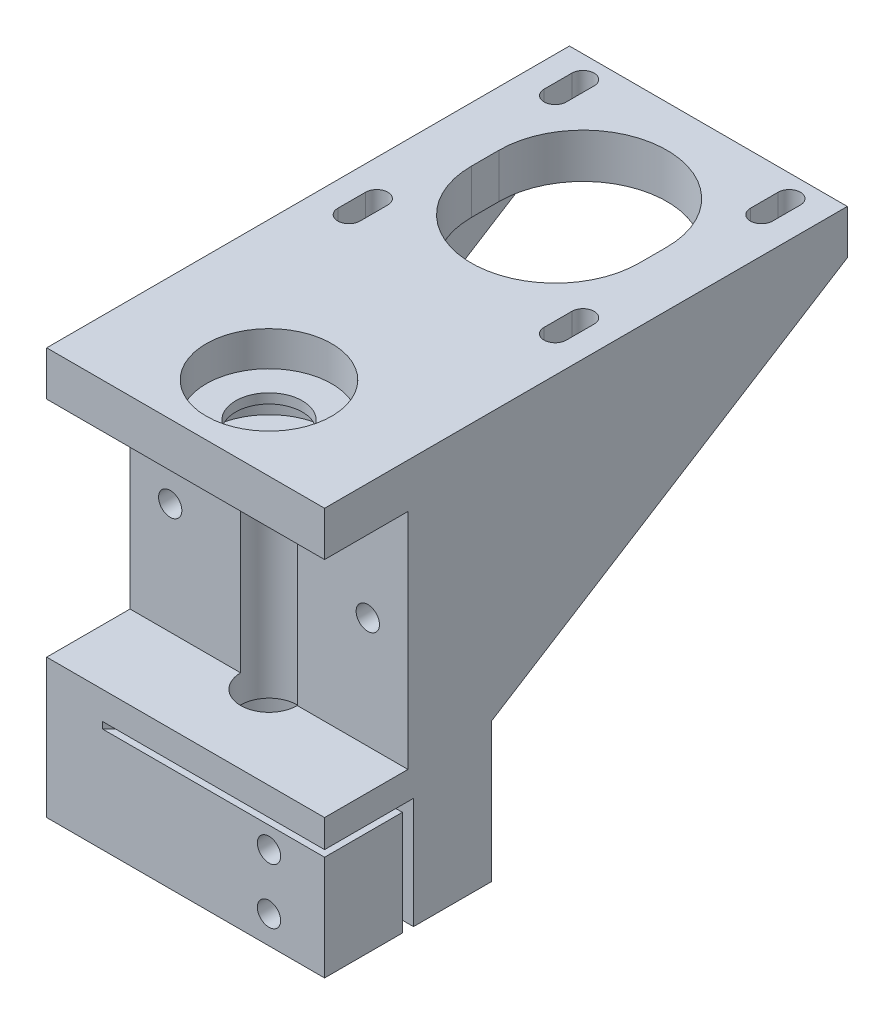
from build123d import *

# Parameters (mm, degrees)
SKETCH1_W            = 50.8
SKETCH1_H            = 38.1
SKETCH1_R            = 13.335
BOSS_EXTRUDE2_DEPTH  = 25.4
CUT_EXTRUDE1_REACH   = 42.66
SKETCH2_W            = 25.4
SKETCH2_H            = 2.54
SKETCH3_R            = 2.665
CUT_EXTRUDE2_DEPTH   = 53.363441445
CUT_EXTRUDE3_DEPTH   = 10
CUT_EXTRUDE4_START   = -1.5
CUT_EXTRUDE4_DEPTH   = 1.5
SKETCH6_W            = 50.8
SKETCH6_H            = 38.1
SKETCH6_R            = 6.477
BOSS_EXTRUDE3_DEPTH  = 6.35
BOSS_EXTRUDE4_DEPTH  = 44.45
BOSS_EXTRUDE5_DEPTH  = 6.604
SKETCH11_W           = 57.15
SKETCH11_H           = 127
BOSS_EXTRUDE6_DEPTH  = 10.16
CUT_EXTRUDE6_REACH   = 147.3
SKETCH12_R           = 7.62
SKETCH13_R           = 14.351
CUT_EXTRUDE7_DEPTH   = 7.9375
CUT_EXTRUDE8_REACH   = 147.3
CUT_EXTRUDE11_REACH  = 141.019
CUT_EXTRUDE12_REACH  = 147.3
SKETCH16_W           = 57.15
SKETCH16_H           = 7.545
SKETCH17_W           = 17.78
SKETCH17_H           = 23.9
BOSS_EXTRUDE7_DEPTH  = 3.175
BOSS_EXTRUDE8_DEPTH  = 3.175
BOSS_EXTRUDE10_DEPTH = 3.175
SKETCH20_W           = 17.78
SKETCH20_H           = 23.9
BOSS_EXTRUDE11_DEPTH = 3.175
CUT_EXTRUDE13_REACH  = 129.55
SKETCH21_R           = 2.665


with BuildPart() as part:
    # Sketch1 → Boss-Extrude2 (new body)
    with BuildSketch(Plane(origin=(0, 0, 0), x_dir=(1, 0, 0), z_dir=(0, 1, 0))):
        Rectangle(SKETCH1_W, SKETCH1_H)
        with Locations(Location((0, 0, 0), (0, 0, 270))):
            Circle(SKETCH1_R, mode=Mode.SUBTRACT)
    extrude(amount=BOSS_EXTRUDE2_DEPTH)

    # Sketch2 → Cut-Extrude1 (cut, up to next)
    with BuildSketch(Plane(origin=(0, 25.4, 0), x_dir=(1, 0, 0), z_dir=(0, 1, 0)), mode=Mode.PRIVATE) as cut_extrude1_sk1:
        with Locations((12.7, 0)):
            Rectangle(SKETCH2_W, SKETCH2_H)
    cut_extrude1_tool1 = extrude(cut_extrude1_sk1.sketch, amount=-CUT_EXTRUDE1_REACH, mode=Mode.PRIVATE) & part.part
    add(cut_extrude1_tool1.solids().sort_by_distance((12.7, 25.4, 0))[0], mode=Mode.SUBTRACT)

    # Sketch3 → Cut-Extrude2 (cut, through all)
    with BuildSketch(Plane.XY.offset(19.05)):
        with Locations((19.05, 19.05)):
            Circle(SKETCH3_R)
        with Locations((19.05, 6.35)):
            Circle(SKETCH3_R)
    extrude(amount=-CUT_EXTRUDE2_DEPTH, mode=Mode.SUBTRACT)

    # Sketch4 → Cut-Extrude3 (cut)
    with BuildSketch(Plane(origin=(0, 0, -19.05), x_dir=(-1, 0, 0), z_dir=(0, 0, -1))):
        Polygon((-19.05, 24.823502692), (-24.05, 21.936751346), (-24.05, 16.163248654), (-19.05, 13.276497308), (-14.05, 16.163248654), (-14.05, 21.936751346), align=None)
        Polygon((-19.05, 12.123502692), (-24.05, 9.236751346), (-24.05, 3.463248654), (-19.05, 0.576497308), (-14.05, 3.463248654), (-14.05, 9.236751346), align=None)
    extrude(amount=-CUT_EXTRUDE3_DEPTH, mode=Mode.SUBTRACT)

    # Sketch5 → Cut-Extrude4 (cut)
    with BuildSketch(Plane(origin=(0, 25.4, 0), x_dir=(1, 0, 0), z_dir=(0, 1, 0)).offset(CUT_EXTRUDE4_START)):
        with BuildLine():
            Line((-19.05, -19.05), (-9.429268927, -9.429268927))
            ThreePointArc((-9.429268927, -9.429268927), (4.509949975, -12.549206199), (13.27438605, -1.27))
            Line((13.27438605, -1.27), (25.4, -1.27))
            Line((25.4, -1.27), (25.4, -19.05))
            Line((25.4, -19.05), (-19.05, -19.05))
        make_face()
    extrude(amount=CUT_EXTRUDE4_DEPTH, mode=Mode.SUBTRACT)

    # Sketch6 → Boss-Extrude3 (add)
    with BuildSketch(Plane(origin=(0, 25.4, 0), x_dir=(1, 0, 0), z_dir=(0, 1, 0))):
        Rectangle(SKETCH6_W, SKETCH6_H)
        with Locations(Location((0, 0, 0), (0, 0, 270))):
            Circle(SKETCH6_R, mode=Mode.SUBTRACT)
    extrude(amount=BOSS_EXTRUDE3_DEPTH)

    # Sketch8 → Boss-Extrude4 (add)
    with BuildSketch(Plane(origin=(0, 31.75, 0), x_dir=(1, 0, 0), z_dir=(0, 1, 0))):
        with BuildLine():
            Line((-25.4, 19.05), (25.4, 19.05))
            Line((25.4, 19.05), (25.4, 0))
            Line((25.4, 0), (6.477, 0))
            ThreePointArc((6.477, 0), (0, 6.477), (-6.477, 0))
            Line((-6.477, 0), (-25.4, 0))
            Line((-25.4, 0), (-25.4, 19.05))
        make_face()
    extrude(amount=BOSS_EXTRUDE4_DEPTH)

    # Sketch10 → Boss-Extrude5 (add)
    with BuildSketch(Plane(origin=(0, 76.2, 0), x_dir=(1, 0, 0), z_dir=(0, 1, 0))):
        with BuildLine():
            Line((-25.4, 19.05), (-25.4, 0))
            Line((-25.4, 0), (-13.97, 0))
            ThreePointArc((-13.97, 0), (0, 13.97), (13.97, 0))
            Line((13.97, 0), (25.4, 0))
            Line((25.4, 0), (25.4, 19.05))
            Line((25.4, 19.05), (-25.4, 19.05))
        make_face()
    extrude(amount=BOSS_EXTRUDE5_DEPTH)

    # Sketch11 → Boss-Extrude6 (add)
    with BuildSketch(Plane(origin=(0, 82.804, 0), x_dir=(1, 0, 0), z_dir=(0, 1, 0))):
        with Locations((0, 44.45)):
            Rectangle(SKETCH11_W, SKETCH11_H)
    extrude(amount=BOSS_EXTRUDE6_DEPTH)

    # Sketch12 → Cut-Extrude6 (cut, up to next)
    with BuildSketch(Plane(origin=(0, 92.964, 0), x_dir=(1, 0, 0), z_dir=(0, 1, 0)), mode=Mode.PRIVATE) as cut_extrude6_sk1:
        with Locations(Location((0, 0, 0), (0, 0, 270))):
            Circle(SKETCH12_R)
    cut_extrude6_tool1 = extrude(cut_extrude6_sk1.sketch, amount=-CUT_EXTRUDE6_REACH, mode=Mode.PRIVATE) & part.part
    add(cut_extrude6_tool1.solids().sort_by_distance((0, 92.964, 0))[0], mode=Mode.SUBTRACT)

    # Sketch13 → Cut-Extrude7 (cut)
    with BuildSketch(Plane(origin=(0, 92.964, 0), x_dir=(1, 0, 0), z_dir=(0, 1, 0))):
        with Locations(Location((0, 0, 0), (0, 0, 270))):
            Circle(SKETCH13_R)
    extrude(amount=-CUT_EXTRUDE7_DEPTH, mode=Mode.SUBTRACT)

    # Sketch14 → Cut-Extrude8 (cut, up to next)
    with BuildSketch(Plane(origin=(0, 92.964, 0), x_dir=(1, 0, 0), z_dir=(0, 1, 0)), mode=Mode.PRIVATE) as cut_extrude8_sk1:
        with BuildLine():
            Line((-19.177, 65.405), (-19.177, 71.755))
            ThreePointArc((-19.177, 71.755), (0, 90.932), (19.177, 71.755))
            Line((19.177, 71.755), (19.177, 65.405))
            ThreePointArc((19.177, 65.405), (0, 46.228), (-19.177, 65.405))
        make_face()
    cut_extrude8_tool1 = extrude(cut_extrude8_sk1.sketch, amount=-CUT_EXTRUDE8_REACH, mode=Mode.PRIVATE) & part.part
    add(cut_extrude8_tool1.solids().sort_by_distance((0, 92.964, -68.58))[0], mode=Mode.SUBTRACT)

    # Sketch15 → Cut-Extrude11 (cut, up to next)
    with BuildSketch(Plane.XZ.offset(-82.804), mode=Mode.PRIVATE) as cut_extrude11_sk1:
        with BuildLine():
            Line((-21.03, -88.975), (-21.03, -95.325))
            ThreePointArc((-21.03, -95.325), (-23.57, -97.865), (-26.11, -95.325))
            Line((-26.11, -95.325), (-26.11, -88.975))
            ThreePointArc((-26.11, -88.975), (-23.57, -86.435), (-21.03, -88.975))
        make_face()
    cut_extrude11_tool1 = extrude(cut_extrude11_sk1.sketch, amount=-CUT_EXTRUDE11_REACH, mode=Mode.PRIVATE) & part.part
    # Sketch15 → Cut-Extrude11 (cut, up to next)
    with BuildSketch(Plane.XZ.offset(-82.804), mode=Mode.PRIVATE) as cut_extrude11_sk2:
        with BuildLine():
            Line((26.11, -88.975), (26.11, -95.325))
            ThreePointArc((26.11, -95.325), (23.57, -97.865), (21.03, -95.325))
            Line((21.03, -95.325), (21.03, -88.975))
            ThreePointArc((21.03, -88.975), (23.57, -86.435), (26.11, -88.975))
        make_face()
    cut_extrude11_tool2 = extrude(cut_extrude11_sk2.sketch, amount=-CUT_EXTRUDE11_REACH, mode=Mode.PRIVATE) & part.part
    # Sketch15 → Cut-Extrude11 (cut, up to next)
    with BuildSketch(Plane.XZ.offset(-82.804), mode=Mode.PRIVATE) as cut_extrude11_sk3:
        with BuildLine():
            Line((26.11, -41.835), (26.11, -48.185))
            ThreePointArc((26.11, -48.185), (23.57, -50.725), (21.03, -48.185))
            Line((21.03, -48.185), (21.03, -41.835))
            ThreePointArc((21.03, -41.835), (23.57, -39.295), (26.11, -41.835))
        make_face()
    cut_extrude11_tool3 = extrude(cut_extrude11_sk3.sketch, amount=-CUT_EXTRUDE11_REACH, mode=Mode.PRIVATE) & part.part
    # Sketch15 → Cut-Extrude11 (cut, up to next)
    with BuildSketch(Plane.XZ.offset(-82.804), mode=Mode.PRIVATE) as cut_extrude11_sk4:
        with BuildLine():
            Line((-21.03, -41.835), (-21.03, -48.185))
            ThreePointArc((-21.03, -48.185), (-23.57, -50.725), (-26.11, -48.185))
            Line((-26.11, -48.185), (-26.11, -41.835))
            ThreePointArc((-26.11, -41.835), (-23.57, -39.295), (-21.03, -41.835))
        make_face()
    cut_extrude11_tool4 = extrude(cut_extrude11_sk4.sketch, amount=-CUT_EXTRUDE11_REACH, mode=Mode.PRIVATE) & part.part
    add(cut_extrude11_tool1.solids().sort_by_distance((-23.57, 82.804, -92.15))[0], mode=Mode.SUBTRACT)
    add(cut_extrude11_tool2.solids().sort_by_distance((23.57, 82.804, -92.15))[0], mode=Mode.SUBTRACT)
    add(cut_extrude11_tool3.solids().sort_by_distance((23.57, 82.804, -45.01))[0], mode=Mode.SUBTRACT)
    add(cut_extrude11_tool4.solids().sort_by_distance((-23.57, 82.804, -45.01))[0], mode=Mode.SUBTRACT)

    # Sketch16 → Cut-Extrude12 (cut, up to next)
    with BuildSketch(Plane(origin=(0, 92.964, 0), x_dir=(1, 0, 0), z_dir=(0, 1, 0)), mode=Mode.PRIVATE) as cut_extrude12_sk1:
        with Locations((0, 104.1775)):
            Rectangle(SKETCH16_W, SKETCH16_H)
    cut_extrude12_tool1 = extrude(cut_extrude12_sk1.sketch, amount=-CUT_EXTRUDE12_REACH, mode=Mode.PRIVATE) & part.part
    add(cut_extrude12_tool1.solids().sort_by_distance((0, 92.964, -104.1775))[0], mode=Mode.SUBTRACT)

    # Sketch17 → Boss-Extrude7 (add)
    with BuildSketch(Plane(origin=(25.4, 0, 0), x_dir=(0, 0, -1), z_dir=(1, 0, 0))):
        with Locations((-10.16, 11.95)):
            Rectangle(SKETCH17_W, SKETCH17_H)
        Polygon((19.05, 0), (19.05, 82.804), (0, 82.804), (0, 31.75), (-19.05, 31.75), (-19.05, 25.4), (1.27, 25.4), (1.27, 0), align=None)
    extrude(amount=BOSS_EXTRUDE7_DEPTH)

    # Sketch18 → Boss-Extrude8 (add)
    with BuildSketch(Plane.ZY.offset(25.4)):
        Polygon((-19.05, 0), (19.05, 0), (19.05, 31.75), (0, 31.75), (0, 82.804), (-19.05, 82.804), align=None)
    extrude(amount=BOSS_EXTRUDE8_DEPTH)

    # Sketch19 → Boss-Extrude10 (add)
    with BuildSketch(Plane.ZY.offset(28.575)):
        Polygon((0, 92.964), (-100.405, 92.964), (-100.405, 82.804), (-19.05, 82.804), (-19.05, 31.75), (0, 31.75), (0, 82.804), (19.05, 82.804), (19.05, 92.964), align=None)
        Polygon((0, 31.75), (-19.05, 31.75), (-19.05, 0), (19.05, 0), (19.05, 31.75), align=None)
        Polygon((-19.05, 82.804), (-100.405, 82.804), (-19.05, 31.75), align=None)
    extrude(amount=BOSS_EXTRUDE10_DEPTH)

    # Sketch20 → Boss-Extrude11 (add)
    with BuildSketch(Plane(origin=(28.575, 0, 0), x_dir=(0, 0, -1), z_dir=(1, 0, 0))):
        Polygon((19.05, 31.75), (100.405, 82.804), (100.405, 92.964), (-19.05, 92.964), (-19.05, 82.804), (0, 82.804), (0, 31.75), (-19.05, 31.75), (-19.05, 25.4), (1.27, 25.4), (1.27, 0), (19.05, 0), align=None)
        with Locations((-10.16, 11.95)):
            Rectangle(SKETCH20_W, SKETCH20_H)
    extrude(amount=BOSS_EXTRUDE11_DEPTH)

    # Sketch21 → Cut-Extrude13 (cut, up to next)
    with BuildSketch(Plane(origin=(0, 0, -19.05), x_dir=(-1, 0, 0), z_dir=(0, 0, -1)), mode=Mode.PRIVATE) as cut_extrude13_sk1:
        with Locations((22.575, 57.15)):
            Circle(SKETCH21_R)
    cut_extrude13_tool1 = extrude(cut_extrude13_sk1.sketch, amount=-CUT_EXTRUDE13_REACH, mode=Mode.PRIVATE) & part.part
    # Sketch21 → Cut-Extrude13 (cut, up to next)
    with BuildSketch(Plane(origin=(0, 0, -19.05), x_dir=(-1, 0, 0), z_dir=(0, 0, -1)), mode=Mode.PRIVATE) as cut_extrude13_sk2:
        with Locations((-22.575, 57.15)):
            Circle(SKETCH21_R)
    cut_extrude13_tool2 = extrude(cut_extrude13_sk2.sketch, amount=-CUT_EXTRUDE13_REACH, mode=Mode.PRIVATE) & part.part
    add(cut_extrude13_tool1.solids().sort_by_distance((-22.575, 57.15, -19.05))[0], mode=Mode.SUBTRACT)
    add(cut_extrude13_tool2.solids().sort_by_distance((22.575, 57.15, -19.05))[0], mode=Mode.SUBTRACT)


solid = part.part
